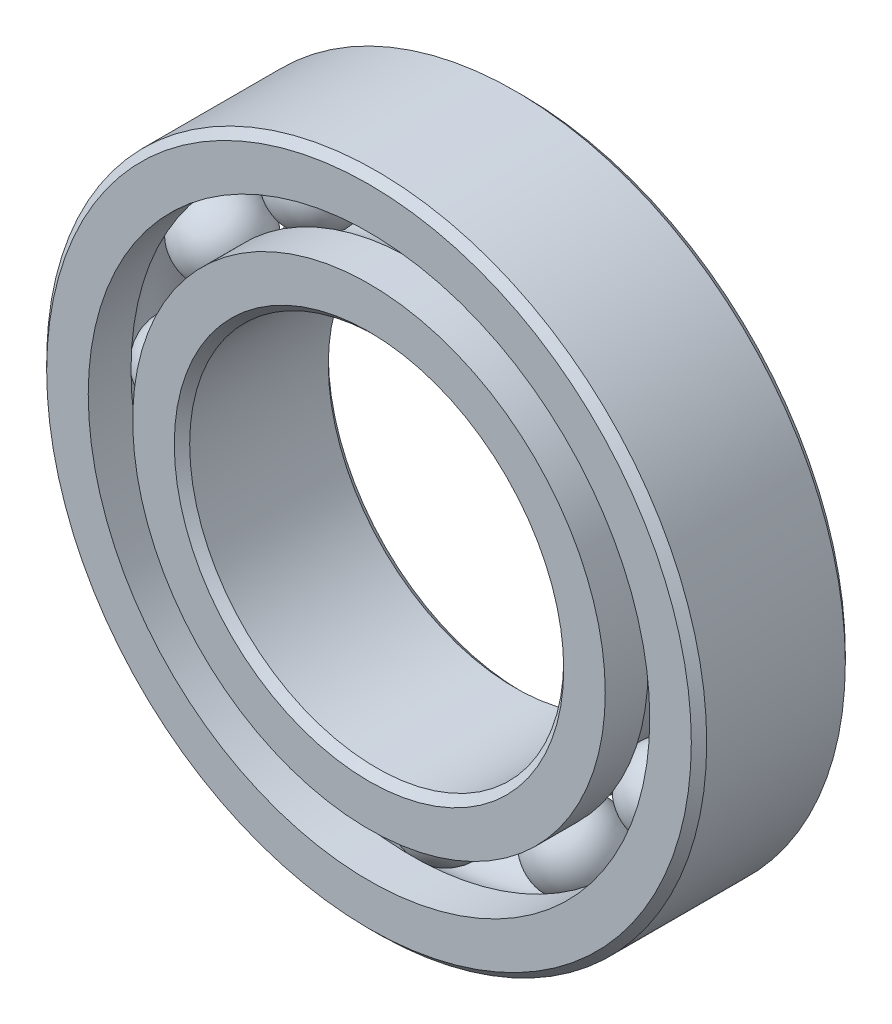
from build123d import *

# Parameters (mm, degrees)
CIRPATTERN1_COUNT = 12


with BuildPart() as part:
    # Sketch1 → Revolve1 (revolve)
    with BuildSketch(Plane(origin=(0, 0, 0), x_dir=(0, 0, -1), z_dir=(1, 0, 0))):
        with BuildLine():
            Line((3.15, 15), (-3.15, 15))
            Line((-3.15, 15), (-3.5, 14.65))
            Line((-3.5, 14.65), (-3.5, 12.760989011))
            Line((-3.5, 12.760989011), (-1.555555556, 12.760989011))
            ThreePointArc((-1.555555556, 12.760989011), (0, 13.605222862), (1.555555556, 12.760989011))
            Line((1.555555556, 12.760989011), (3.5, 12.760989011))
            Line((3.5, 12.760989011), (3.5, 14.65))
            Line((3.5, 14.65), (3.15, 15))
        make_face()
    revolve(axis=Axis((0, 0, 3.5), (0, 0, -1)))


with BuildPart() as body_2:
    # Sketch3 → Revolve3 (revolve)
    with BuildSketch(Plane(origin=(0, 0, 0), x_dir=(0, 0, -1), z_dir=(1, 0, 0))):
        with BuildLine():
            Line((-3.5, 10.739010989), (-1.555555556, 10.739010989))
            ThreePointArc((-1.555555556, 10.739010989), (0, 9.894777138), (1.555555556, 10.739010989))
            Line((1.555555556, 10.739010989), (3.5, 10.739010989))
            Line((3.5, 10.739010989), (3.5, 8.85))
            Line((3.5, 8.85), (3.15, 8.5))
            Line((3.15, 8.5), (-3.15, 8.5))
            Line((-3.15, 8.5), (-3.5, 8.85))
            Line((-3.5, 8.85), (-3.5, 10.739010989))
        make_face()
    revolve(axis=Axis((0, 0, 3.5), (0, 0, -1)))


with BuildPart() as body_3:
    # Sketch4 → Revolve4 (revolve)
    with BuildSketch(Plane(origin=(0, 0, 0), x_dir=(0, 0, -1), z_dir=(1, 0, 0))):
        with BuildLine():
            Line((-1.855222862, 11.75), (1.855222862, 11.75))
            ThreePointArc((1.855222862, 11.75), (0, 13.605222862), (-1.855222862, 11.75))
        make_face()
    revolve(axis=Axis((0, 11.75, 1.855222862), (0, 0, -1)))


with BuildPart() as cirpattern1_1:
    # CirPattern1: pattern copy
    add(body_3.part.rotate(Axis((0, 0, -3.5), (0, 0, 1)), 1 * 360 / CIRPATTERN1_COUNT))


with BuildPart() as cirpattern1_2:
    # CirPattern1: pattern copy
    add(body_3.part.rotate(Axis((0, 0, -3.5), (0, 0, 1)), 2 * 360 / CIRPATTERN1_COUNT))


with BuildPart() as cirpattern1_3:
    # CirPattern1: pattern copy
    add(body_3.part.rotate(Axis((0, 0, -3.5), (0, 0, 1)), 3 * 360 / CIRPATTERN1_COUNT))


with BuildPart() as cirpattern1_4:
    # CirPattern1: pattern copy
    add(body_3.part.rotate(Axis((0, 0, -3.5), (0, 0, 1)), 4 * 360 / CIRPATTERN1_COUNT))


with BuildPart() as cirpattern1_5:
    # CirPattern1: pattern copy
    add(body_3.part.rotate(Axis((0, 0, -3.5), (0, 0, 1)), 5 * 360 / CIRPATTERN1_COUNT))


with BuildPart() as cirpattern1_6:
    # CirPattern1: pattern copy
    add(body_3.part.rotate(Axis((0, 0, -3.5), (0, 0, 1)), 6 * 360 / CIRPATTERN1_COUNT))


with BuildPart() as cirpattern1_7:
    # CirPattern1: pattern copy
    add(body_3.part.rotate(Axis((0, 0, -3.5), (0, 0, 1)), 7 * 360 / CIRPATTERN1_COUNT))


with BuildPart() as cirpattern1_8:
    # CirPattern1: pattern copy
    add(body_3.part.rotate(Axis((0, 0, -3.5), (0, 0, 1)), 8 * 360 / CIRPATTERN1_COUNT))


with BuildPart() as cirpattern1_9:
    # CirPattern1: pattern copy
    add(body_3.part.rotate(Axis((0, 0, -3.5), (0, 0, 1)), 9 * 360 / CIRPATTERN1_COUNT))


with BuildPart() as cirpattern1_10:
    # CirPattern1: pattern copy
    add(body_3.part.rotate(Axis((0, 0, -3.5), (0, 0, 1)), 10 * 360 / CIRPATTERN1_COUNT))


with BuildPart() as cirpattern1_11:
    # CirPattern1: pattern copy
    add(body_3.part.rotate(Axis((0, 0, -3.5), (0, 0, 1)), 11 * 360 / CIRPATTERN1_COUNT))


solid = Compound([part.part, body_2.part, body_3.part, cirpattern1_1.part, cirpattern1_2.part, cirpattern1_3.part, cirpattern1_4.part, cirpattern1_5.part, cirpattern1_6.part, cirpattern1_7.part, cirpattern1_8.part, cirpattern1_9.part, cirpattern1_10.part, cirpattern1_11.part])
